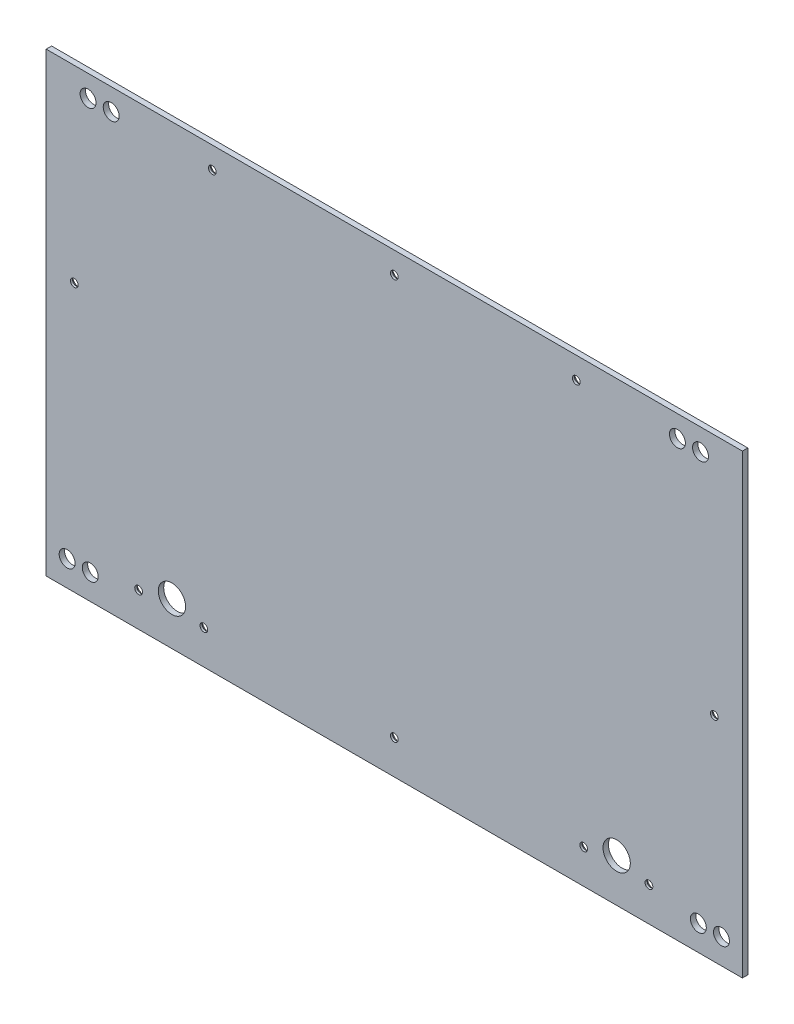
from build123d import *

# Parameters (mm, degrees)
SKETCH1_W                                      = 306.05
SKETCH1_H                                      = 197.425
SKETCH1_R                                      = 10.775
BOSS_EXTRUDE1_DEPTH                            = 2.38125
SKETCH9_W                                      = 306.05
SKETCH9_H                                      = 2.38125
BOSS_EXTRUDE2_DEPTH                            = 3.175
SKETCH10_R                                     = 3.5
CUT_EXTRUDE1_DEPTH                             = 184.856965146
CSK_FOR_M3_FLAT_HEAD_MACHINE_SCREW1_AT_2_COUNT = 2
CSK_FOR_M3_FLAT_HEAD_MACHINE_SCREW1_AT_2_PITCH = 28.69
CSK_FOR_M3_FLAT_HEAD_MACHINE_SCREW1_AT_3_COUNT = 2
CSK_FOR_M3_FLAT_HEAD_MACHINE_SCREW1_AT_3_PITCH = 83.856540491
CSK_FOR_M3_FLAT_HEAD_MACHINE_SCREW1_AT_4_COUNT = 2
CSK_FOR_M3_FLAT_HEAD_MACHINE_SCREW1_AT_4_PITCH = 178.948509983
CSK_FOR_M3_FLAT_HEAD_MACHINE_SCREW1_AT_5_COUNT = 2
CSK_FOR_M3_FLAT_HEAD_MACHINE_SCREW1_AT_5_PITCH = 208.645558843
CSK_FOR_M3_FLAT_HEAD_MACHINE_SCREW1_AT_6_COUNT = 2
CSK_FOR_M3_FLAT_HEAD_MACHINE_SCREW1_AT_6_PITCH = 260.467597265
CSK_FOR_M3_FLAT_HEAD_MACHINE_SCREW1_AT_7_COUNT = 2
CSK_FOR_M3_FLAT_HEAD_MACHINE_SCREW1_AT_7_PITCH = 272.733119364
CSK_FOR_M3_FLAT_HEAD_MACHINE_SCREW1_AT_8_COUNT = 2
CSK_FOR_M3_FLAT_HEAD_MACHINE_SCREW1_AT_8_PITCH = 224.342
CSK_FOR_M3_FLAT_HEAD_MACHINE_SCREW1_AT_9_COUNT = 2
CSK_FOR_M3_FLAT_HEAD_MACHINE_SCREW1_AT_9_PITCH = 195.652
CSK_FOR_M3_FLAT_HEAD_MACHINE_SCREW1_AT_1_COUNT = 2
CSK_FOR_M3_FLAT_HEAD_MACHINE_SCREW1_AT_1_PITCH = 111.94
SKETCH13_R                                     = 5.999999997
CUT_EXTRUDE2_DEPTH                             = 184.856965146


with BuildPart() as part:
    # Sketch1 → Boss-Extrude1 (new body)
    # profile 1 of 5: a face of its own
    with BuildSketch(Plane.XY):
        Rectangle(SKETCH1_W, SKETCH1_H)
        with Locations((-142.25, -87.9375)):
            Circle(SKETCH1_R, mode=Mode.SUBTRACT)
        with Locations((-130.25, -64.9375)):
            Circle(SKETCH1_R, mode=Mode.SUBTRACT)
    # profile 2 of 5: a face of its own
    with BuildSketch(Plane.XY):
        with Locations((-130.25, -64.9375)):
            Circle(SKETCH1_R)
    # profile 3 of 5: a face of its own
    with BuildSketch(Plane.XY):
        with Locations((-142.25, -87.9375)):
            Circle(SKETCH1_R)
    # profile 4 of 5: a face of its own
    with BuildSketch(Plane.XY):
        with BuildLine():
            ThreePointArc((-142.25, -98.7125), (-149.869075567, -95.556575567), (-153.025, -87.9375))
            Line((-153.025, -87.9375), (-153.025, -98.7125))
            Line((-153.025, -98.7125), (-142.25, -98.7125))
        make_face()
    # profile 5 of 5: a face of its own
    with BuildSketch(Plane.XY):
        Rectangle(SKETCH1_W, SKETCH1_H)
    extrude(amount=BOSS_EXTRUDE1_DEPTH)

    # Sketch9 → Boss-Extrude2 (add)
    with BuildSketch(Plane(origin=(0, 98.7125, 0), x_dir=(1, 0, 0), z_dir=(0, 1, 0))):
        with Locations((0, -1.190625)):
            Rectangle(SKETCH9_W, SKETCH9_H)
    extrude(amount=BOSS_EXTRUDE2_DEPTH)

    # Sketch10 → Cut-Extrude1 (cut, through all)
    with BuildSketch(Plane(origin=(0, 0, 0), x_dir=(-1, 0, 0), z_dir=(0, 0, -1))):
        with Locations((-134.610000066, 92.362499989)):
            Circle(SKETCH10_R)
        with Locations((-124.450000066, 92.362499989)):
            Circle(SKETCH10_R)
        with Locations((-143.817500066, -87.537500111)):
            Circle(SKETCH10_R)
        with Locations((-133.657500066, -87.537500111)):
            Circle(SKETCH10_R)
    cut_extrude1 = extrude(amount=-CUT_EXTRUDE1_DEPTH, mode=Mode.SUBTRACT)

    # Mirror1: Cut-Extrude1 across plane
    add(cut_extrude1.mirror(Plane(origin=(0, 0, 0), x_dir=(0, 0, 1), z_dir=(1, 0, 0))), mode=Mode.SUBTRACT)

    # Sketch12 → CSK for M3 Flat Head Machine Screw1 (revolve, cut)
    with BuildSketch(Plane(origin=(111.94, -83.7125, 0), x_dir=(0, 1, 0), z_dir=(1, 0, 0))):
        Polygon((0, 0), (0, 2.38125), (1.7, 2.38125), (1.7, 1.45), (3.15, 0), align=None)
    csk_for_m3_flat_head_machine_screw1 = revolve(axis=Axis((111.94, -83.7125, -6.35), (0, 0, 1)), mode=Mode.SUBTRACT)

    # CSK for M3 Flat Head Machine Screw1 at 2: CSK for M3 Flat Head Machine Screw1 ×2
    with Locations(*[(-i * CSK_FOR_M3_FLAT_HEAD_MACHINE_SCREW1_AT_2_PITCH, 0, 0) for i in range(1, CSK_FOR_M3_FLAT_HEAD_MACHINE_SCREW1_AT_2_COUNT)]):
        add(csk_for_m3_flat_head_machine_screw1, mode=Mode.SUBTRACT)

    # CSK for M3 Flat Head Machine Screw1 at 3: CSK for M3 Flat Head Machine Screw1 ×2
    with Locations(*[Vector(0.34281762477474764, 0.9394019779326636, 0) * (i * CSK_FOR_M3_FLAT_HEAD_MACHINE_SCREW1_AT_3_PITCH) for i in range(1, CSK_FOR_M3_FLAT_HEAD_MACHINE_SCREW1_AT_3_COUNT)]):
        add(csk_for_m3_flat_head_machine_screw1, mode=Mode.SUBTRACT)

    # CSK for M3 Flat Head Machine Screw1 at 4: CSK for M3 Flat Head Machine Screw1 ×2
    with Locations(*[Vector(-0.17848709666882537, 0.9839422525345344, 0) * (i * CSK_FOR_M3_FLAT_HEAD_MACHINE_SCREW1_AT_4_PITCH) for i in range(1, CSK_FOR_M3_FLAT_HEAD_MACHINE_SCREW1_AT_4_COUNT)]):
        add(csk_for_m3_flat_head_machine_screw1, mode=Mode.SUBTRACT)

    # CSK for M3 Flat Head Machine Screw1 at 5: CSK for M3 Flat Head Machine Screw1 ×2
    with Locations(*[Vector(-0.5365079449598532, 0.8438952689729663, 0) * (i * CSK_FOR_M3_FLAT_HEAD_MACHINE_SCREW1_AT_5_PITCH) for i in range(1, CSK_FOR_M3_FLAT_HEAD_MACHINE_SCREW1_AT_5_COUNT)]):
        add(csk_for_m3_flat_head_machine_screw1, mode=Mode.SUBTRACT)

    # CSK for M3 Flat Head Machine Screw1 at 6: CSK for M3 Flat Head Machine Screw1 ×2
    with Locations(*[Vector(-0.7369054808176366, 0.6759957931384839, 0) * (i * CSK_FOR_M3_FLAT_HEAD_MACHINE_SCREW1_AT_6_PITCH) for i in range(1, CSK_FOR_M3_FLAT_HEAD_MACHINE_SCREW1_AT_6_COUNT)]):
        add(csk_for_m3_flat_head_machine_screw1, mode=Mode.SUBTRACT)

    # CSK for M3 Flat Head Machine Screw1 at 7: CSK for M3 Flat Head Machine Screw1 ×2
    with Locations(*[Vector(-0.9262809761508288, 0.37683358823367613, 0) * (i * CSK_FOR_M3_FLAT_HEAD_MACHINE_SCREW1_AT_7_PITCH) for i in range(1, CSK_FOR_M3_FLAT_HEAD_MACHINE_SCREW1_AT_7_COUNT)]):
        add(csk_for_m3_flat_head_machine_screw1, mode=Mode.SUBTRACT)

    # CSK for M3 Flat Head Machine Screw1 at 8: CSK for M3 Flat Head Machine Screw1 ×2
    with Locations(*[(-i * CSK_FOR_M3_FLAT_HEAD_MACHINE_SCREW1_AT_8_PITCH, 0, 0) for i in range(1, CSK_FOR_M3_FLAT_HEAD_MACHINE_SCREW1_AT_8_COUNT)]):
        add(csk_for_m3_flat_head_machine_screw1, mode=Mode.SUBTRACT)

    # CSK for M3 Flat Head Machine Screw1 at 9: CSK for M3 Flat Head Machine Screw1 ×2
    with Locations(*[(-i * CSK_FOR_M3_FLAT_HEAD_MACHINE_SCREW1_AT_9_PITCH, 0, 0) for i in range(1, CSK_FOR_M3_FLAT_HEAD_MACHINE_SCREW1_AT_9_COUNT)]):
        add(csk_for_m3_flat_head_machine_screw1, mode=Mode.SUBTRACT)

    # CSK for M3 Flat Head Machine Screw1 at 1: CSK for M3 Flat Head Machine Screw1 ×2
    with Locations(*[(-i * CSK_FOR_M3_FLAT_HEAD_MACHINE_SCREW1_AT_1_PITCH, 0, 0) for i in range(1, CSK_FOR_M3_FLAT_HEAD_MACHINE_SCREW1_AT_1_COUNT)]):
        add(csk_for_m3_flat_head_machine_screw1, mode=Mode.SUBTRACT)

    # Sketch13 → Cut-Extrude2 (cut, through all)
    with BuildSketch(Plane(origin=(0, 0, 0), x_dir=(-1, 0, 0), z_dir=(0, 0, -1))):
        with Locations((-97.75, -79.7125001)):
            Circle(SKETCH13_R)
        with Locations((97.75, -79.7125001)):
            Circle(SKETCH13_R)
    extrude(amount=-CUT_EXTRUDE2_DEPTH, mode=Mode.SUBTRACT)


solid = part.part
